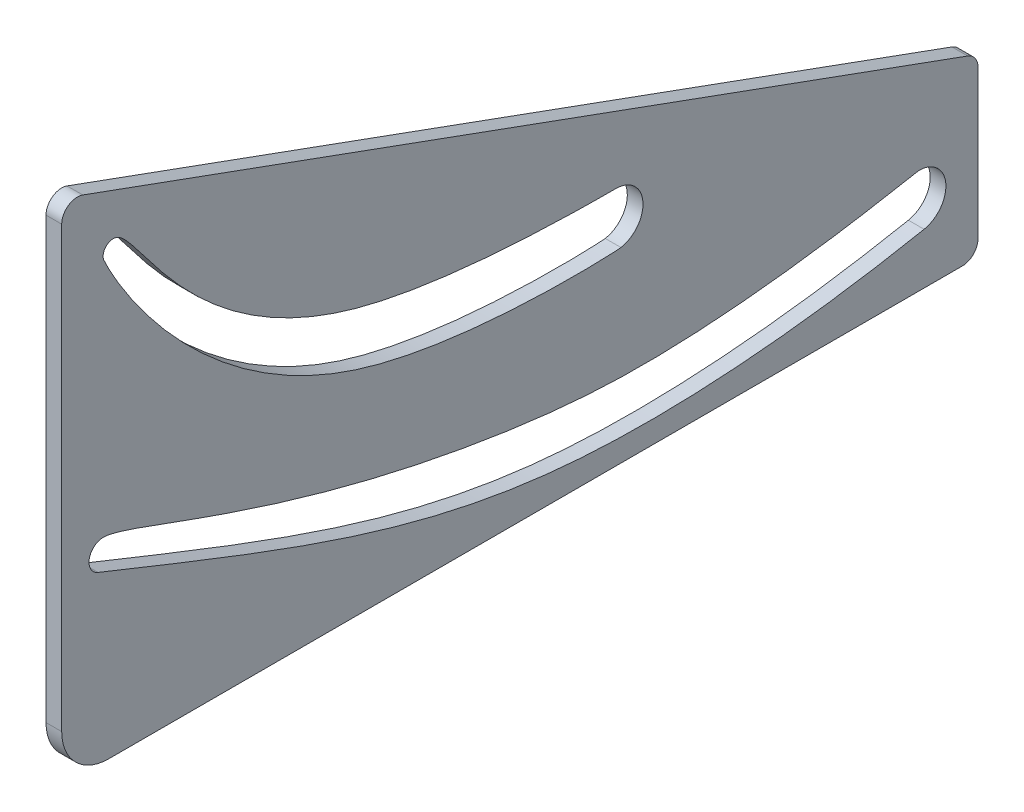
from build123d import *

# Parameters (mm, degrees)
BOSS_EXTRUDE1_DEPTH = 10
CUT_EXTRUDE3_DEPTH  = 33


with BuildPart() as part:
    # Sketch1 → Boss-Extrude1 (new body)
    with BuildSketch(Plane(origin=(0, 0, 0), x_dir=(0, 0, -1), z_dir=(1, 0, 0))):
        with BuildLine():
            Line((0, -14.281480067), (0, -294.281480067))
            ThreePointArc((0, -294.281480067), (8.786796564, -315.494683503), (30, -324.281480067))
            Line((30, -324.281480067), (573.815572472, -324.281480067))
            ThreePointArc((573.815572472, -324.281480067), (580.886640283, -321.352547879), (583.815572472, -314.281480067))
            Line((583.815572472, -314.281480067), (583.815572472, -219.493566063))
            ThreePointArc((583.815572472, -219.493566063), (582.007092914, -213.757801699), (577.235773905, -210.096639855))
            Line((577.235773905, -210.096639855), (13.420201433, -4.88455386))
            ThreePointArc((13.420201433, -4.88455386), (4.264235636, -6.089959625), (0, -14.281480067))
        make_face()
    extrude(amount=BOSS_EXTRUDE1_DEPTH)

    # Sketch3 → Cut-Extrude3 (cut)
    with BuildSketch(Plane.ZY):
        with BuildLine():
            ThreePointArc((-23.162175785, -218.017297737), (-17.576945532, -207.678107035), (-26.738120061, -200.318314743))
            add(Edge.make_bspline(
                [(-26.738120061, -200.318314743), (-45.914354434, -200.660753587), (-151.32107334, -255.510398156), (-414.880335601, -286.385074175), (-542.431128002, -257.731725159), (-546.154906269, -257.731029979)],
                knots=[0, 0, 0, 0, 0.560935224, 0.660935224, 1, 1, 1, 1], degree=3))
            ThreePointArc((-546.154906269, -257.731029979), (-563.288388976, -273.27487263), (-549.474047026, -291.831036849))
            add(Edge.make_bspline(
                [(-549.474047026, -291.831036849), (-474.750080899, -306.502271197), (-284.669923623, -324.572171749), (-143.080818041, -266.034178467), (-23.162175785, -218.017297737)],
                knots=[0, 0, 0, 0, 0.423888314, 1, 1, 1, 1], degree=3))
        make_face()
        with BuildLine():
            ThreePointArc((-26.950185671, -47.737214996), (-28.17113687, -40.715672082), (-35.124917897, -39.154353359))
            add(Edge.make_bspline(
                [(-35.124917897, -39.154353359), (-50.602952828, -45.122445935), (-99.042539, -170.661871263), (-331.224003862, -171.181746235), (-353.169530365, -171.181734297)],
                knots=[0, 0, 0, 0, 0.639195597, 1, 1, 1, 1], degree=3))
            ThreePointArc((-353.169530365, -171.181734297), (-370.309371751, -186.812434708), (-356.32010769, -205.316311305))
            add(Edge.make_bspline(
                [(-356.32010769, -205.316311305), (-352.838937223, -205.964445921), (-121.396454164, -217.989087479), (-35.312726243, -66.629555086), (-26.950185671, -47.737214996)],
                knots=[0, 0, 0, 0, 0.40968467, 1, 1, 1, 1], degree=3))
        make_face()
    extrude(amount=-CUT_EXTRUDE3_DEPTH, mode=Mode.SUBTRACT)


solid = part.part
